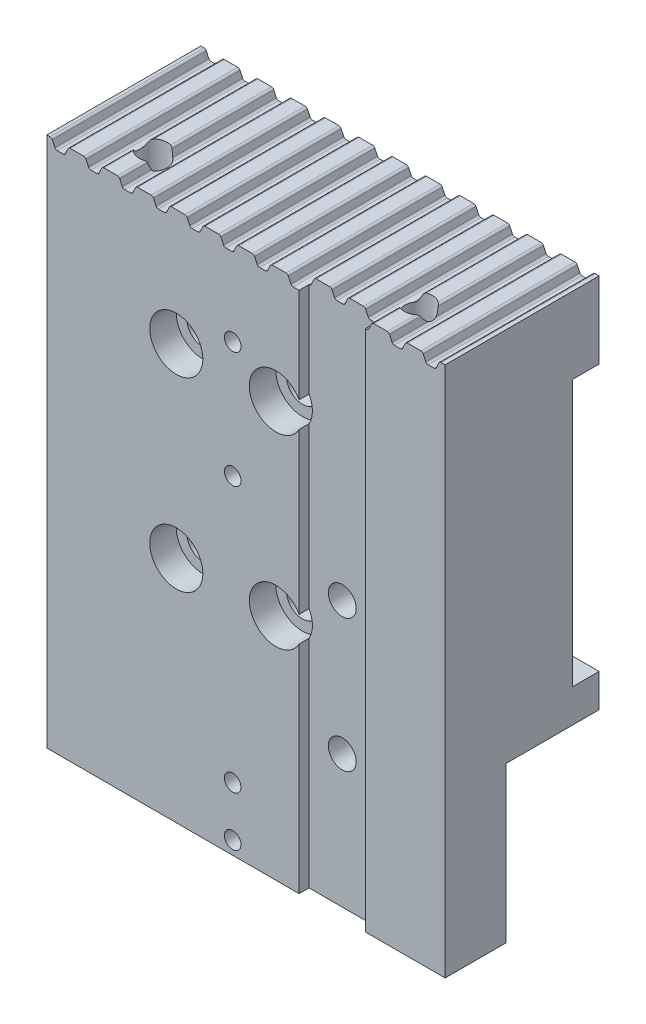
from build123d import *

# Parameters (mm, degrees)
SKETCH_1_W                     = 60
SKETCH_1_H                     = 80
EXTRUDE_1_DEPTH                = 23.2
SKETCH_2_W                     = 4
SKETCH_2_H                     = 40.1
CUT_EXTRUDE_1_DEPTH            = 103.655930175
CUT_EXTRUDE_2_DEPTH            = 103.655930175
FILLET_1_R                     = 0.38
PATTERN_LINEAR_1_COUNT         = 12
PATTERN_LINEAR_1_PITCH         = 5.08
FILLET_1_OF_PATTERN_LINEAR_1_R = 0.38
SKETCH_5_W                     = 14
SKETCH_5_H                     = 23.4
CUT_EXTRUDE_4_DEPTH            = 103.655930175
SKETCH_6_W                     = 10
SKETCH_6_H                     = 85
CUT_EXTRUDE_5_DEPTH            = 1.5
HOLE_WIZARD_M5_1_D             = 4.2
HOLE_WIZARD_M5_1_DEPTH         = 12.4
HOLE_WIZARD_M5_1_TIP           = 1.2618073
HOLE_WIZARD_M5_2_D             = 4.2
HOLE_WIZARD_M5_2_DEPTH         = 12.4
HOLE_WIZARD_M5_2_TIP           = 1.2618073
HOLE_WIZARD_M3_1_D             = 2.5
HOLE_WIZARD_M4_1_D             = 4.8
HOLE_WIZARD_M4_1_CBORE_D       = 8
HOLE_WIZARD_M4_1_CBORE_DEPTH   = 4
HOLE_WIZARD_M3_2_D             = 2.5
HOLE_WIZARD_M5_3_D             = 4.2
HOLE_WIZARD_M5_3_DEPTH         = 12.4
HOLE_WIZARD_M5_3_TIP           = 1.2618073


with BuildPart() as part:
    # 草图1 → 凸台-拉伸1 (new body)
    with BuildSketch(Plane.XY):
        with Locations((30, 40)):
            Rectangle(SKETCH_1_W, SKETCH_1_H)
    extrude(amount=-EXTRUDE_1_DEPTH)

    # 草图2 → 切除-拉伸1 (cut, through all)
    with BuildSketch(Plane.ZY):
        with Locations((-21.2, 48.45)):
            Rectangle(SKETCH_2_W, SKETCH_2_H)
    extrude(amount=-CUT_EXTRUDE_1_DEPTH, mode=Mode.SUBTRACT)

    # 草图3 → 切除-拉伸2 (cut, through all)
    with BuildSketch(Plane.XY):
        Polygon((0.715, 80), (1.307210726, 78.73), (2.692789274, 78.73), (3.285, 80), align=None)
    cut_extrude_2 = extrude(amount=-CUT_EXTRUDE_2_DEPTH, mode=Mode.SUBTRACT)

    # 圆角1
    fillet_1_edges = [part.edges().sort_by_distance(p)[0] for p in [
        (0.715, 80, -11.6),
        (3.285, 80, -11.6),
        (2.692789274, 78.73, -11.6),
        (1.307210726, 78.73, -11.6),
    ]]
    fillet(fillet_1_edges, radius=FILLET_1_R)

    # 阵列(线性)1: 切除-拉伸2 ×12
    with Locations(*[(i * PATTERN_LINEAR_1_PITCH, 0, 0) for i in range(1, PATTERN_LINEAR_1_COUNT)]):
        add(cut_extrude_2, mode=Mode.SUBTRACT)

    # 圆角1 of 阵列(线性)1
    fillet_1_of_pattern_linear_1_edges = [part.edges().sort_by_distance(p)[0] for p in [
        (5.795, 80, -11.6),
        (8.365, 80, -11.6),
        (7.772789274, 78.73, -11.6),
        (6.387210726, 78.73, -11.6),
        (10.875, 80, -11.6),
        (13.445, 80, -11.6),
        (12.852789274, 78.73, -11.6),
        (11.467210726, 78.73, -11.6),
        (15.955, 80, -11.6),
        (18.525, 80, -11.6),
        (17.932789274, 78.73, -11.6),
        (16.547210726, 78.73, -11.6),
        (21.035, 80, -11.6),
        (23.605, 80, -11.6),
        (23.012789274, 78.73, -11.6),
        (21.627210726, 78.73, -11.6),
        (26.115, 80, -11.6),
        (28.685, 80, -11.6),
        (28.092789274, 78.73, -11.6),
        (26.707210726, 78.73, -11.6),
        (31.195, 80, -11.6),
        (33.765, 80, -11.6),
        (33.172789274, 78.73, -11.6),
        (31.787210726, 78.73, -11.6),
        (36.275, 80, -11.6),
        (38.845, 80, -11.6),
        (38.252789274, 78.73, -11.6),
        (36.867210726, 78.73, -11.6),
        (41.355, 80, -11.6),
        (43.925, 80, -11.6),
        (43.332789274, 78.73, -11.6),
        (41.947210726, 78.73, -11.6),
        (46.435, 80, -11.6),
        (49.005, 80, -11.6),
        (48.412789274, 78.73, -11.6),
        (47.027210726, 78.73, -11.6),
        (51.515, 80, -11.6),
        (54.085, 80, -11.6),
        (53.492789274, 78.73, -11.6),
        (52.107210726, 78.73, -11.6),
        (56.595, 80, -11.6),
        (59.165, 80, -11.6),
        (58.572789274, 78.73, -11.6),
        (57.187210726, 78.73, -11.6),
    ]]
    fillet(fillet_1_of_pattern_linear_1_edges, radius=FILLET_1_OF_PATTERN_LINEAR_1_R)

    # 草图5 → 切除-拉伸4 (cut, through all)
    with BuildSketch(Plane.ZY):
        with Locations((-16.2, 11.7)):
            Rectangle(SKETCH_5_W, SKETCH_5_H)
    extrude(amount=-CUT_EXTRUDE_4_DEPTH, mode=Mode.SUBTRACT)

    # 草图6 → 切除-拉伸5 (cut)
    with BuildSketch(Plane.XY):
        with Locations((43, 42.5)):
            Rectangle(SKETCH_6_W, SKETCH_6_H)
    extrude(amount=-CUT_EXTRUDE_5_DEPTH, mode=Mode.SUBTRACT)

    # M5 螺纹孔1
    with Locations(Plane(origin=(0, 80, 0), x_dir=(-1, 0, 0), z_dir=(0, 1, 0))):
        with Locations((-10, -6), (-50, -6)):
            Hole(HOLE_WIZARD_M5_1_D / 2, depth=HOLE_WIZARD_M5_1_DEPTH)
            with Locations((0, 0, -(HOLE_WIZARD_M5_1_DEPTH + HOLE_WIZARD_M5_1_TIP / 2))):  # 118° drill point
                Cone(0, HOLE_WIZARD_M5_1_D / 2, HOLE_WIZARD_M5_1_TIP, mode=Mode.SUBTRACT)

    # M5 螺纹孔2
    with Locations(Plane.XY.offset(-1.5)):
        with Locations((43, 40), (43, 20)):
            Hole(HOLE_WIZARD_M5_2_D / 2, depth=HOLE_WIZARD_M5_2_DEPTH)
            with Locations((0, 0, -(HOLE_WIZARD_M5_2_DEPTH + HOLE_WIZARD_M5_2_TIP / 2))):  # 118° drill point
                Cone(0, HOLE_WIZARD_M5_2_D / 2, HOLE_WIZARD_M5_2_TIP, mode=Mode.SUBTRACT)

    # M3 螺纹孔1 (through all)
    with Locations(Plane.XY):
        with Locations((28, 9.5), (28, 67)):
            Hole(HOLE_WIZARD_M3_1_D / 2)

    # M4 六角凹头螺钉的柱形沉头孔1 (through all)
    with Locations(Plane.XY):
        with Locations((19.5, 62.5), (34.5, 62.5), (34.5, 34.5), (19.5, 34.5)):
            CounterBoreHole(HOLE_WIZARD_M4_1_D / 2, HOLE_WIZARD_M4_1_CBORE_D / 2, HOLE_WIZARD_M4_1_CBORE_DEPTH)

    # M3 螺纹孔2 (through all)
    with Locations(Plane.XY):
        with Locations((28, 2), (28, 49.5)):
            Hole(HOLE_WIZARD_M3_2_D / 2)

    # M5 螺纹孔3
    with Locations(Plane.ZY):
        with Locations((-6, 45)):
            Hole(HOLE_WIZARD_M5_3_D / 2, depth=HOLE_WIZARD_M5_3_DEPTH)
            with Locations((0, 0, -(HOLE_WIZARD_M5_3_DEPTH + HOLE_WIZARD_M5_3_TIP / 2))):  # 118° drill point
                Cone(0, HOLE_WIZARD_M5_3_D / 2, HOLE_WIZARD_M5_3_TIP, mode=Mode.SUBTRACT)


solid = part.part
